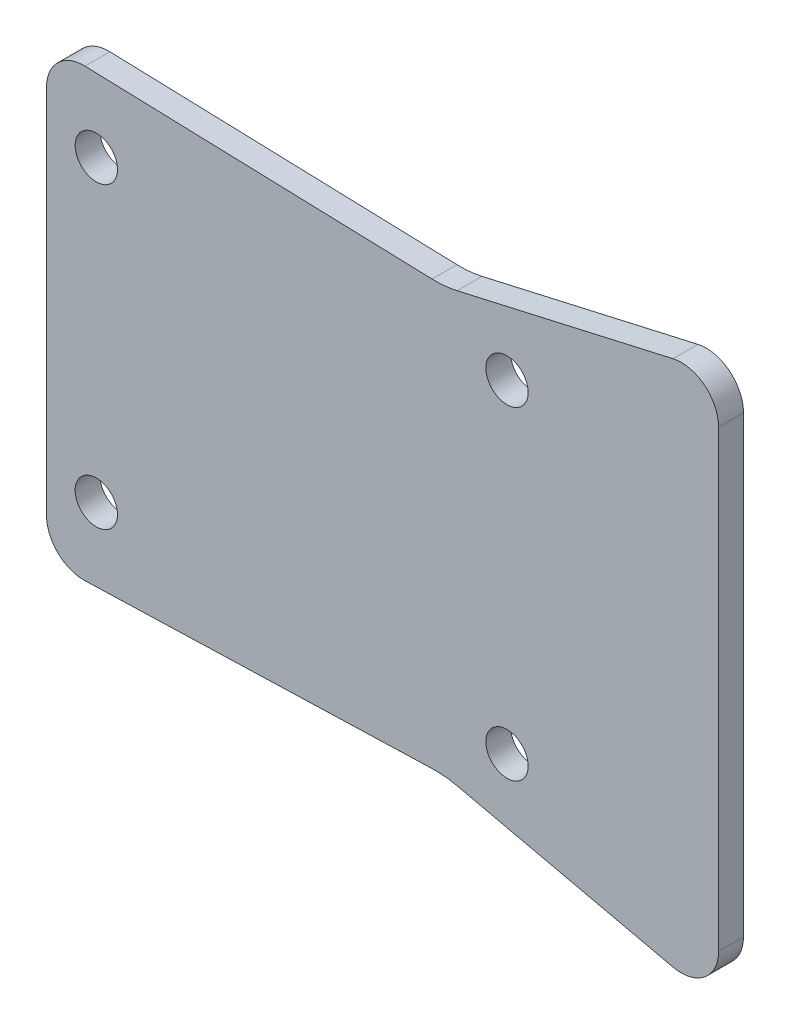
from build123d import *

# Parameters (mm, degrees)
UNDERSIDE_COVER_T2_DEPTH         = 2
SKETCH_2_R                       = 1.7
CLOSURE_ONLY_FOUR_M3_HOLES_DEPTH = 2


with BuildPart() as part:
    # 草图1 → Underside_cover_T2 (new body)
    with BuildSketch(Plane.XY):
        with BuildLine():
            Line((41.093704257, -17.903321742), (68.976089412, -17.031997206))
            ThreePointArc((68.976089412, -17.031997206), (69.993731032, -17.065020347), (70.99893626, -17.227030968))
            Line((70.99893626, -17.227030968), (88.335136689, -21.16707652))
            ThreePointArc((88.335136689, -21.16707652), (90.871551504, -20.586309047), (92, -18.241677953))
            Line((92, -18.241677953), (92, 18.241677953))
            ThreePointArc((92, 18.241677953), (90.871551504, 20.586309047), (88.335136689, 21.16707652))
            Line((88.335136689, 21.16707652), (70.99893626, 17.227030968))
            ThreePointArc((70.99893626, 17.227030968), (69.993731032, 17.065020347), (68.976089412, 17.031997206))
            Line((68.976089412, 17.031997206), (41.093704257, 17.903321742))
            ThreePointArc((41.093704257, 17.903321742), (38.912071933, 17.05898058), (38, 14.904785514))
            Line((38, 14.904785514), (38, -14.904785514))
            ThreePointArc((38, -14.904785514), (38.912071933, -17.05898058), (41.093704257, -17.903321742))
        make_face()
    extrude(amount=UNDERSIDE_COVER_T2_DEPTH)

    # 草图2 → Closure_only_four_M3_holes (cut)
    with BuildSketch(Plane.XY.offset(2)):
        with Locations((42, -12)):
            Circle(SKETCH_2_R)
        with Locations((42, 12)):
            Circle(SKETCH_2_R)
        with Locations((75, -13)):
            Circle(SKETCH_2_R)
        with Locations((75, 13)):
            Circle(SKETCH_2_R)
    extrude(amount=-CLOSURE_ONLY_FOUR_M3_HOLES_DEPTH, mode=Mode.SUBTRACT)


solid = part.part
